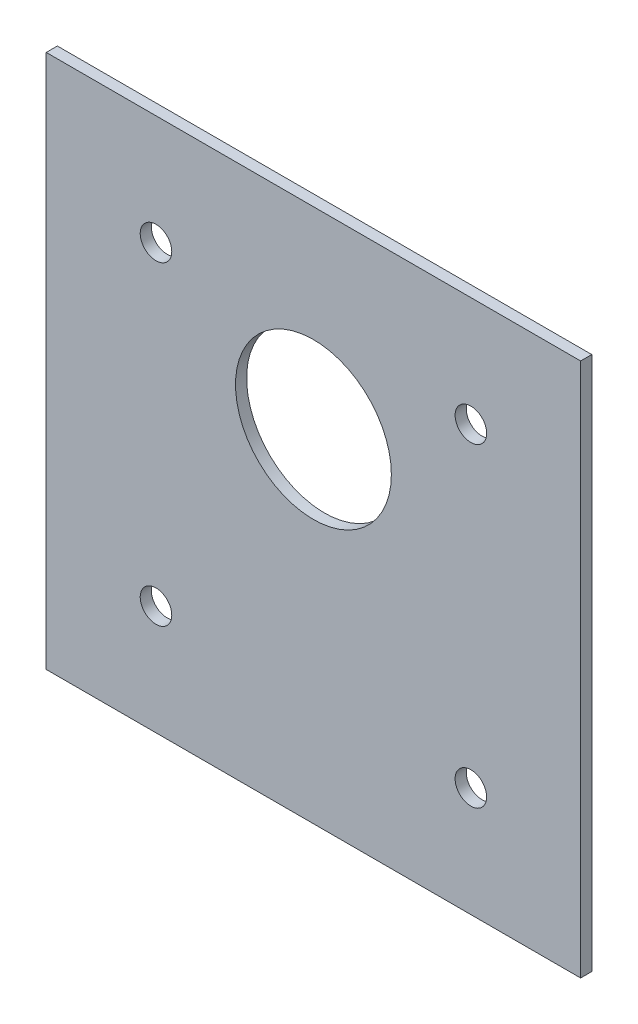
from build123d import *

# Parameters (mm, degrees)
SKETCH1_W           = 104
SKETCH1_H           = 104
SKETCH1_R           = 21
SKETCH1_R_2         = 4.25
BOSS_EXTRUDE1_DEPTH = 3
SKETCH2_W           = 144
SKETCH2_H           = 144
SKETCH2_W_2         = 104
SKETCH2_H_2         = 104
BOSS_EXTRUDE2_DEPTH = 3


with BuildPart() as part:
    # Sketch1 → Boss-Extrude1 (new body)
    with BuildSketch(Plane.XY):
        Rectangle(SKETCH1_W, SKETCH1_H)
        with Locations((0, 20)):
            Circle(SKETCH1_R, mode=Mode.SUBTRACT)
        with Locations((-42.426406871, 42.426406871)):
            Circle(SKETCH1_R_2, mode=Mode.SUBTRACT)
        with Locations((42.426406871, 42.426406871)):
            Circle(SKETCH1_R_2, mode=Mode.SUBTRACT)
        with Locations((42.426406871, -42.426406871)):
            Circle(SKETCH1_R_2, mode=Mode.SUBTRACT)
        with Locations((-42.426406871, -42.426406871)):
            Circle(SKETCH1_R_2, mode=Mode.SUBTRACT)
    extrude(amount=BOSS_EXTRUDE1_DEPTH)

    # Sketch2 → Boss-Extrude2 (add)
    with BuildSketch(Plane(origin=(0, 0, 0), x_dir=(-1, 0, 0), z_dir=(0, 0, -1))):
        Rectangle(SKETCH2_W, SKETCH2_H)
        Rectangle(SKETCH2_W_2, SKETCH2_H_2, mode=Mode.SUBTRACT)
    extrude(amount=-BOSS_EXTRUDE2_DEPTH)


solid = part.part
